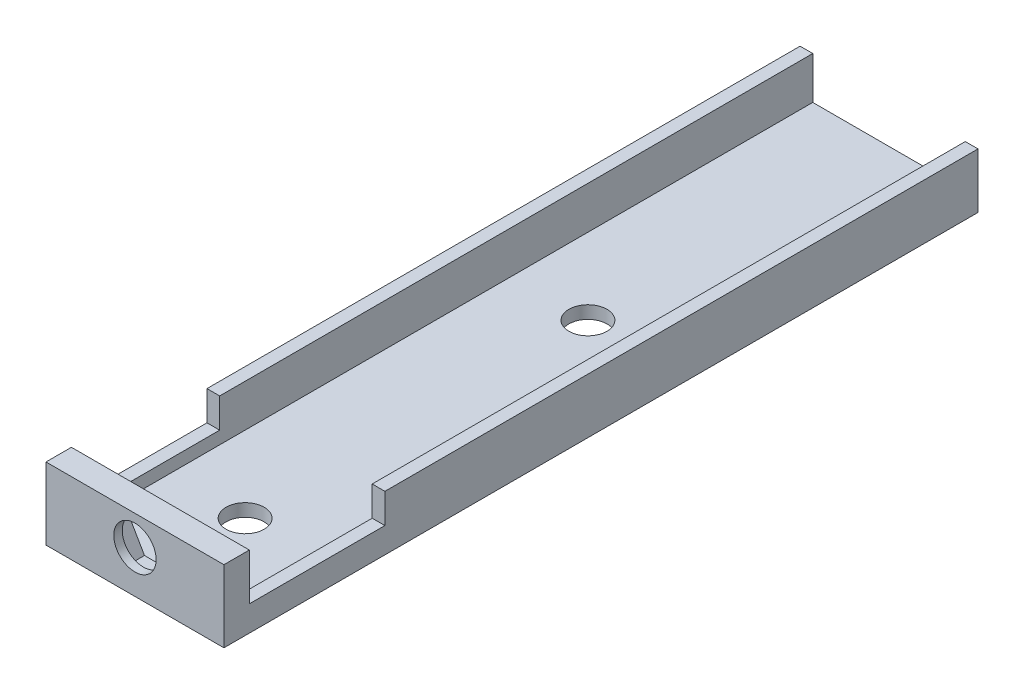
from build123d import *

# Parameters (mm, degrees)
BOSS_EXTRUDE1_DEPTH = 140
BOSS_EXTRUDE2_DEPTH = 36
BOSS_EXTRUDE3_DEPTH = 4
SKETCH3_3_W         = 42
SKETCH3_3_H         = 17
SKETCH3_3_R         = 5
BOSS_EXTRUDE4_DEPTH = 2
SKETCH4_R           = 4.5
CUT_EXTRUDE1_DEPTH  = 184.423008371


with BuildPart() as part:
    # Sketch1 → Boss-Extrude1 (new body)
    with BuildSketch(Plane.XY):
        Polygon((0, 0), (0, 13), (3, 13), (3, 3), (39, 3), (39, 13), (42, 13), (42, 0), align=None)
    extrude(amount=BOSS_EXTRUDE1_DEPTH)

    # Sketch2 → Boss-Extrude2 (add)
    with BuildSketch(Plane.XY.offset(140)):
        Polygon((0, 0), (42, 0), (42, 6), (39, 6), (39, 3), (3, 3), (3, 6), (0, 6), align=None)
    extrude(amount=BOSS_EXTRUDE2_DEPTH)

    # Sketch3 → Boss-Extrude3 (add)
    with BuildSketch(Plane.XY.offset(176)):
        Polygon((0, 17), (0, 6), (3, 6), (3, 3), (39, 3), (39, 6), (42, 6), (42, 17), align=None)
        Polygon((24.75277675, 16.5), (28.505553499, 10), (24.75277675, 3.5), (17.24722325, 3.5), (13.494446501, 10), (17.24722325, 16.5), align=None, mode=Mode.SUBTRACT)
    extrude(amount=-BOSS_EXTRUDE3_DEPTH)

    # Sketch3<3> → Boss-Extrude4 (add)
    with BuildSketch(Plane.XY.offset(176)):
        with Locations((21, 8.5)):
            Rectangle(SKETCH3_3_W, SKETCH3_3_H)
        with Locations((21, 10)):
            Circle(SKETCH3_3_R, mode=Mode.SUBTRACT)
    extrude(amount=BOSS_EXTRUDE4_DEPTH)

    # Sketch4 → Cut-Extrude1 (cut, through all)
    with BuildSketch(Plane(origin=(0, 3, 0), x_dir=(1, 0, 0), z_dir=(0, 1, 0))):
        with Locations((21, -152)):
            Circle(SKETCH4_R)
        with Locations((21, -71.075)):
            Circle(SKETCH4_R)
    extrude(amount=-CUT_EXTRUDE1_DEPTH, mode=Mode.SUBTRACT)


solid = part.part
